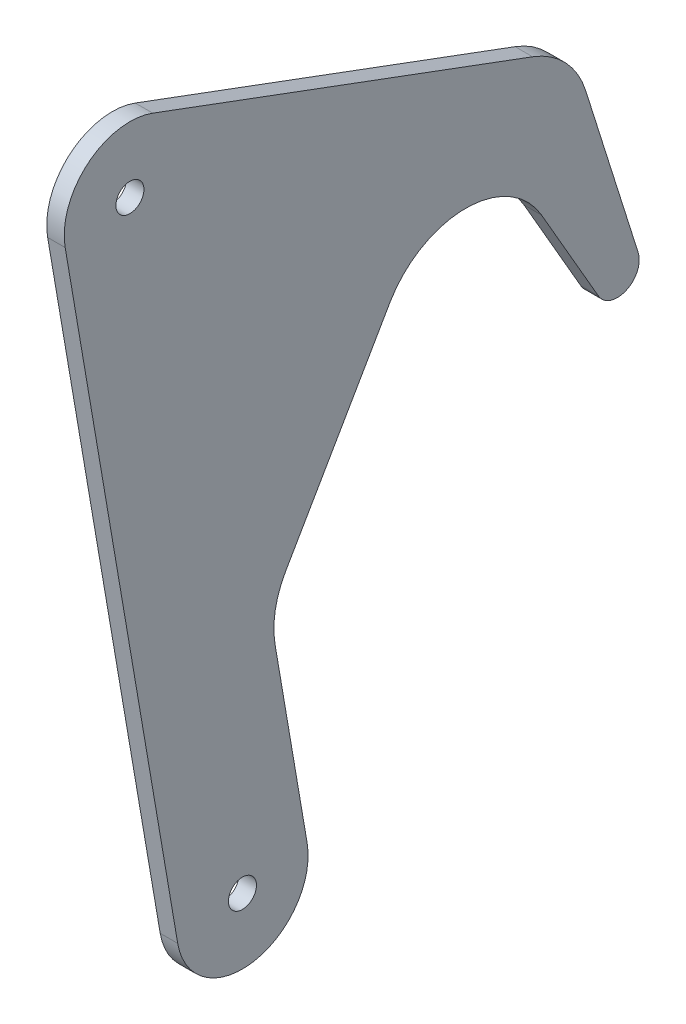
from build123d import *

# Parameters (mm, degrees)
BOSS_EXTRUDE1_DEPTH = 2.54
SKETCH2_R           = 2.032
CUT_EXTRUDE1_DEPTH  = 120.845185189
FILLET1_R           = 12.7


with BuildPart() as part:
    # Sketch1 → Boss-Extrude1 (new body)
    with BuildSketch(Plane(origin=(0, 0, 0), x_dir=(0, 0, -1), z_dir=(1, 0, 0))):
        with BuildLine():
            Line((-25.711264461, 93.961261583), (-9.389037217, -1.603622507))
            ThreePointArc((-9.389037217, -1.603622507), (1.603622507, -9.389037217), (9.389037217, 1.603622507))
            Line((9.389037217, 1.603622507), (4.740879345, 28.818086661))
            ThreePointArc((4.740879345, 28.818086661), (4.758501249, 33.195142409), (6.261073005, 37.306250004))
            Line((6.261073005, 37.306250004), (21.384041616, 63.5))
            ThreePointArc((21.384041616, 63.5), (32.382564244, 69.85), (43.381086873, 63.5))
            Line((43.381086873, 63.5), (51.629978844, 49.2125))
            ThreePointArc((51.629978844, 49.2125), (55.658330241, 47.893886054), (57.407660819, 51.754740913))
            Line((57.407660819, 51.754740913), (47.914524724, 81.863122013))
            Line((47.914524724, 81.863122013), (-13.005337503, 104.493706378))
            ThreePointArc((-13.005337503, 104.493706378), (-22.400947675, 102.898013226), (-25.711264461, 93.961261583))
        make_face()
    extrude(amount=BOSS_EXTRUDE1_DEPTH)

    # Sketch2 → Cut-Extrude1 (cut, through all)
    with BuildSketch(Plane(origin=(2.54, 0, 0), x_dir=(0, 0, -1), z_dir=(1, 0, 0))):
        Circle(SKETCH2_R)
        with Locations((-16.322227244, 95.56488409)):
            Circle(SKETCH2_R)
    extrude(amount=-CUT_EXTRUDE1_DEPTH, mode=Mode.SUBTRACT)

    # Fillet1
    fillet1_edges = [part.edges().sort_by_distance(p)[0] for p in [
        (1.27, 81.863122013, -47.914524724),
    ]]
    fillet(fillet1_edges, radius=FILLET1_R)


solid = part.part
